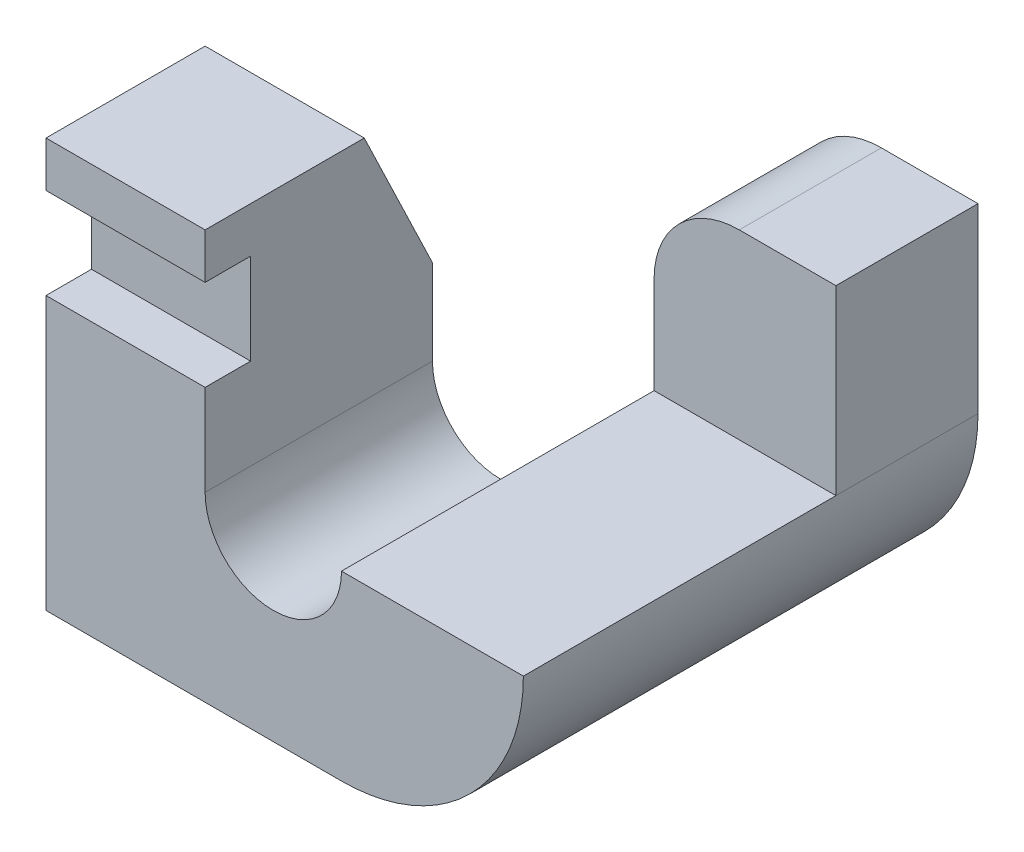
from build123d import *

# Parameters (mm, degrees)
BOSS_EXTRUDE1_DEPTH = 80
BOSS_EXTRUDE2_DEPTH = 25
SKETCH4_W           = 28
SKETCH4_H           = 40
CUT_EXTRUDE1_DEPTH  = 137.528385327
SKETCH5_W           = 8
SKETCH5_H           = 16
CUT_EXTRUDE2_DEPTH  = 55


with BuildPart() as part:
    # Sketch1 → Boss-Extrude1 (new body)
    with BuildSketch(Plane.XY):
        with BuildLine():
            Line((0, 0), (52, 0))
            ThreePointArc((52, 0), (74.627416998, 9.372583002), (84, 32))
            Line((84, 32), (52, 32))
            ThreePointArc((52, 32), (40, 20), (28, 32))
            Line((28, 32), (28, 72))
            Line((28, 72), (0, 72))
            Line((0, 72), (0, 0))
        make_face()
    extrude(amount=BOSS_EXTRUDE1_DEPTH)

    # Sketch3 → Boss-Extrude2 (add)
    with BuildSketch(Plane(origin=(0, 0, 0), x_dir=(-1, 0, 0), z_dir=(0, 0, -1))):
        with BuildLine():
            Line((-52, 32), (-52, 49))
            ThreePointArc((-52, 49), (-56.393398282, 59.606601718), (-67, 64))
            Line((-67, 64), (-84, 64))
            Line((-84, 64), (-84, 32))
            Line((-84, 32), (-52, 32))
        make_face()
    extrude(amount=-BOSS_EXTRUDE2_DEPTH)

    # Sketch4 → Cut-Extrude1 (cut, through all)
    with BuildSketch(Plane(origin=(0, 72, 0), x_dir=(1, 0, 0), z_dir=(0, 1, 0))):
        with Locations((14, -20)):
            Rectangle(SKETCH4_W, SKETCH4_H)
        Polygon((28, 0), (28, -40), (52, -40), (52, -25), (52, 0), align=None)
    extrude(amount=-CUT_EXTRUDE1_DEPTH, mode=Mode.SUBTRACT)

    # Sketch5 → Cut-Extrude2 (cut)
    with BuildSketch(Plane(origin=(28, 0, 0), x_dir=(0, 0, -1), z_dir=(1, 0, 0))):
        Polygon((-40, 72), (-52, 72), (-40, 47), align=None)
        with Locations((-76, 56)):
            Rectangle(SKETCH5_W, SKETCH5_H)
    extrude(amount=-CUT_EXTRUDE2_DEPTH, mode=Mode.SUBTRACT)


solid = part.part
